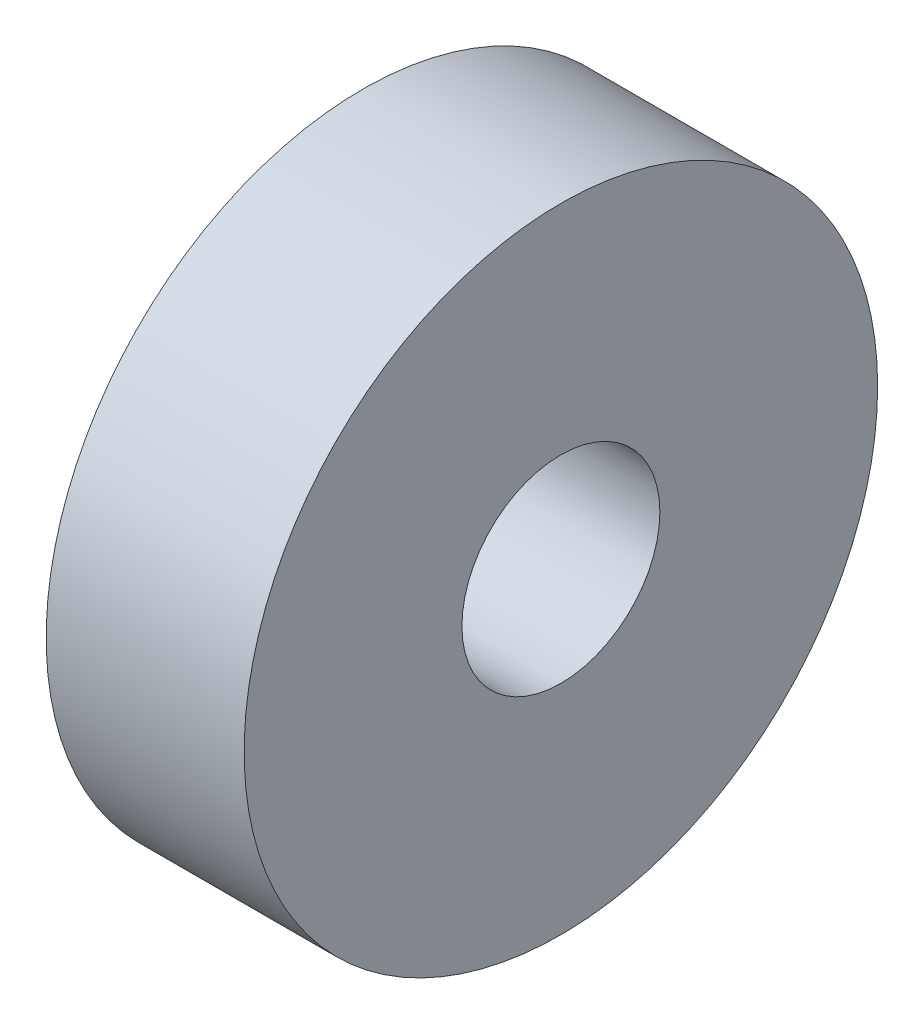
from build123d import *

# Parameters (mm, degrees)
SKETCH1_R           = 8
SKETCH1_R_2         = 2.5
BOSS_EXTRUDE1_DEPTH = 2.5


with BuildPart() as part:
    # Sketch1 → Boss-Extrude1 (new, symmetric)
    with BuildSketch(Plane(origin=(0, 0, 0), x_dir=(0, 0, -1), z_dir=(1, 0, 0))):
        Circle(SKETCH1_R)
        Circle(SKETCH1_R_2, mode=Mode.SUBTRACT)
    extrude(amount=BOSS_EXTRUDE1_DEPTH, both=True)


solid = part.part
